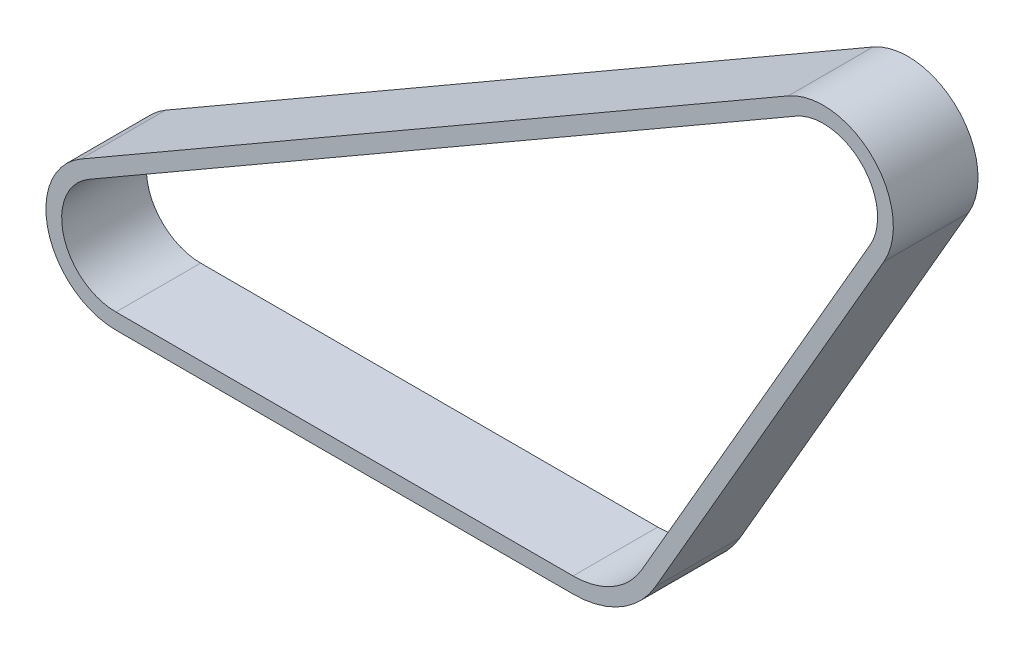
from build123d import *

# Parameters (mm, degrees)
BOSS_EXTRUDE1_DEPTH = 17.0815


with BuildPart() as part:
    # Sketch1 → Boss-Extrude1 (new body)
    with BuildSketch(Plane.XY):
        with BuildLine():
            Line((43.406805694, 89.562005703), (-99.266375, 7.189606424))
            ThreePointArc((-99.266375, 7.189606424), (-105.849324518, -8.703039583), (-92.202, -19.175))
            Line((-92.202, -19.175), (0, -19.175))
            ThreePointArc((0, -19.175), (9.5875, -16.606037118), (16.606037118, -9.5875))
            Line((16.606037118, -9.5875), (62.707037118, 70.26177428))
            ThreePointArc((62.707037118, 70.26177428), (60.461715629, 87.316684214), (43.406805694, 89.562005703))
        make_face()
        with BuildLine():
            Line((-92.202, -16), (0, -16))
            ThreePointArc((0, -16), (8, -13.856406461), (13.856406461, -8))
            Line((13.856406461, -8), (59.957406461, 71.84927428))
            ThreePointArc((59.957406461, 71.84927428), (58.216651598, 85.071620184), (44.994305694, 86.812375046))
            Line((44.994305694, 86.812375046), (-97.678875, 4.439975767))
            ThreePointArc((-97.678875, 4.439975767), (-102.78251002, -7.881289115), (-92.202, -16))
        make_face(mode=Mode.SUBTRACT)
    extrude(amount=BOSS_EXTRUDE1_DEPTH)


solid = part.part
